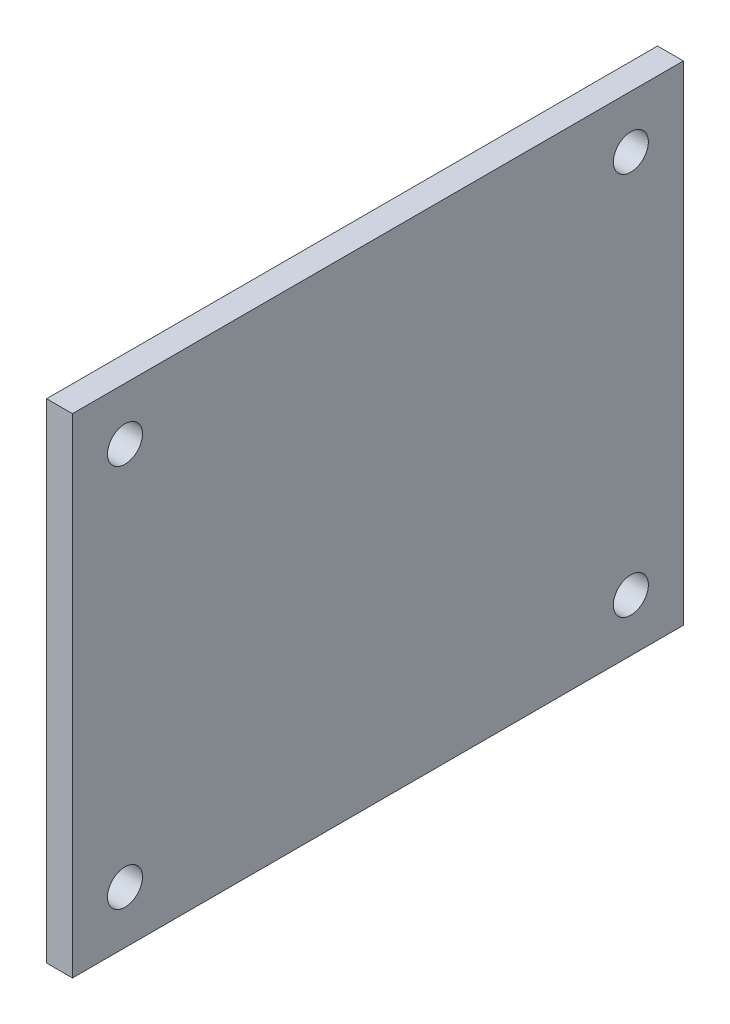
from build123d import *

# Parameters (mm, degrees)
BOSS_EXTRUDE1_DEPTH      = 1.5875
BOSS_EXTRUDE1_DEPTH_BACK = 1.5875
SKETCH1_W                = 75
SKETCH1_H                = 60
CUT_EXTRUDE1_DEPTH       = 49.049663435
CUT_EXTRUDE1_DEPTH_BACK  = 49.049663435
SKETCH2_R                = 2.15


with BuildPart() as part:
    # Sketch1 → Boss-Extrude1 (new, two sides: drawn at the far end of the back side and taken through both)
    with BuildSketch(Plane(origin=(0, 0, 0), x_dir=(0, 0, -1), z_dir=(1, 0, 0)).offset(-BOSS_EXTRUDE1_DEPTH_BACK)):
        Rectangle(SKETCH1_W, SKETCH1_H)
    extrude(amount=BOSS_EXTRUDE1_DEPTH + BOSS_EXTRUDE1_DEPTH_BACK)

    # Sketch2 → Cut-Extrude1 (cut, two sides: drawn at the far end of the back side and taken through both)
    with BuildSketch(Plane(origin=(0, 0, 0), x_dir=(0, 0, -1), z_dir=(1, 0, 0)).offset(-CUT_EXTRUDE1_DEPTH_BACK)):
        with Locations((-31.05, 23.55)):
            Circle(SKETCH2_R)
        with Locations((31.05, 23.55)):
            Circle(SKETCH2_R)
        with Locations((31.05, -23.55)):
            Circle(SKETCH2_R)
        with Locations((-31.05, -23.55)):
            Circle(SKETCH2_R)
    extrude(amount=CUT_EXTRUDE1_DEPTH + CUT_EXTRUDE1_DEPTH_BACK, mode=Mode.SUBTRACT)


solid = part.part
